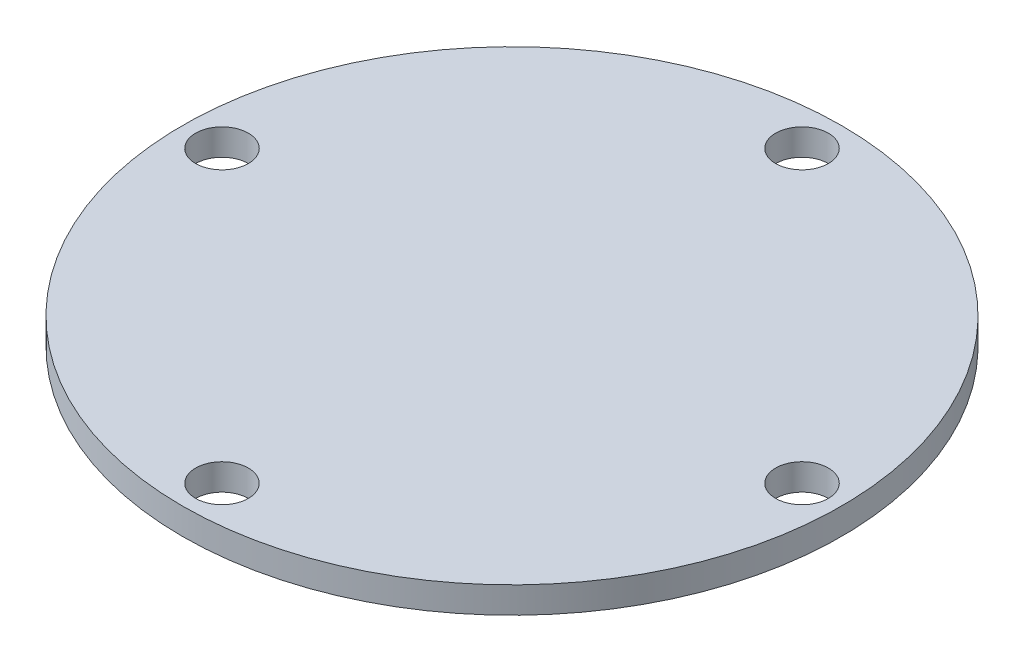
from build123d import *

# Parameters (mm, degrees)
IZIM1_R                     = 25
IZIM1_R_2                   = 2
Y_KSEKLIK_EKSTR_ZYON1_DEPTH = 2
IZIM3_R                     = 1.998800289
KES_EKSTR_ZYON1_DEPTH       = 2


with BuildPart() as part:
    # Çizim1 → Yükseklik-Ekstrüzyon1 (new body)
    with BuildSketch(Plane(origin=(0, 0, 0), x_dir=(1, 0, 0), z_dir=(0, 1, 0))):
        with Locations(Location((0, 0, 0), (0, 0, 270))):
            Circle(IZIM1_R)
        with Locations(Location((-22, 0, 0), (0, 0, 270))):
            Circle(IZIM1_R_2, mode=Mode.SUBTRACT)
        with Locations(Location((22, 0, 0), (0, 0, 270))):
            Circle(IZIM1_R_2, mode=Mode.SUBTRACT)
    extrude(amount=Y_KSEKLIK_EKSTR_ZYON1_DEPTH)

    # Çizim3 → Kes-Ekstrüzyon1 (cut)
    with BuildSketch(Plane(origin=(0, 2, 0), x_dir=(1, 0, 0), z_dir=(0, 1, 0))):
        with Locations(Location((0, 22, 0), (0, 0, 270))):
            Circle(IZIM3_R)
        with Locations(Location((0, -22, 0), (0, 0, 270))):
            Circle(IZIM3_R)
    extrude(amount=-KES_EKSTR_ZYON1_DEPTH, mode=Mode.SUBTRACT)


solid = part.part
